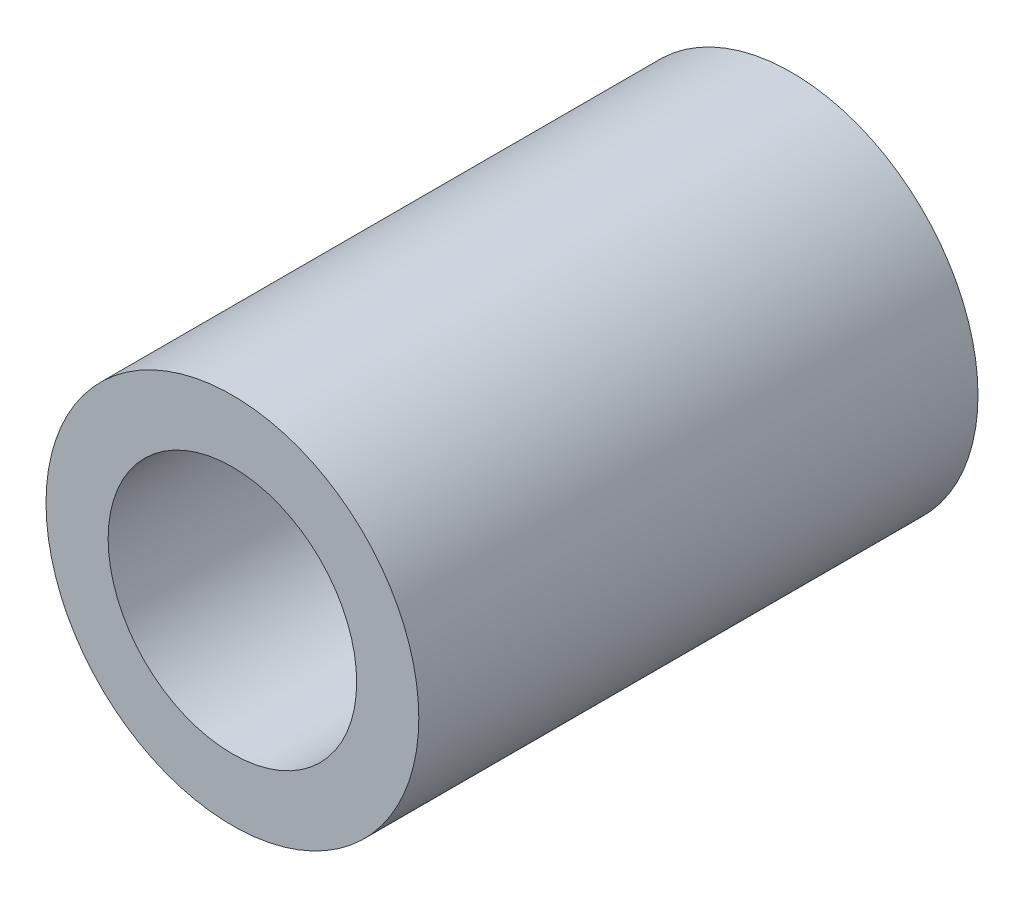
from build123d import *

# Parameters (mm, degrees)
SKETCH1_R           = 2.38125
SKETCH1_R_2         = 1.5875
BOSS_EXTRUDE1_DEPTH = 7.14375


with BuildPart() as part:
    # Sketch1 → Boss-Extrude1 (new body)
    with BuildSketch(Plane.XY):
        Circle(SKETCH1_R)
        Circle(SKETCH1_R_2, mode=Mode.SUBTRACT)
    extrude(amount=BOSS_EXTRUDE1_DEPTH)


solid = part.part
